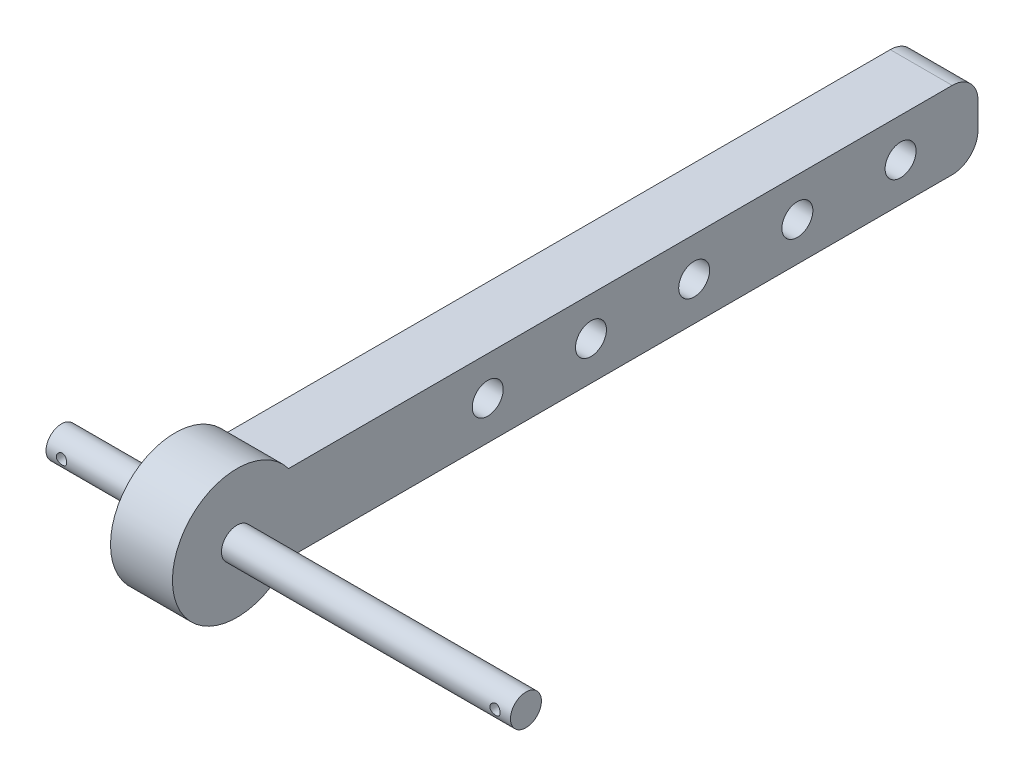
from build123d import *

# Parameters (mm, degrees)
SKETCH_1_W           = 150
SKETCH_1_H           = 15
EXTRUDE_1_DEPTH      = 12
FILLET_1_R           = 5
SKETCH_6_R           = 12.5
EXTRUDE_2_DEPTH      = 12
EXTRUDE_5_DEPTH      = 22
EXTRUDE_5_DEPTH_BACK = 68
SKETCH_15_R          = 3
CUT_EXTRUDE_9_REACH  = 167.904
SKETCH_16_R          = 1
CUT_EXTRUDE_10_REACH = 167.904
SKETCH_17_R          = 3


with BuildPart() as part:
    # 草图1 → 凸台-拉伸1 (new body)
    with BuildSketch(Plane(origin=(0, 0, 0), x_dir=(0, 0, -1), z_dir=(1, 0, 0))):
        with Locations((75, 7.5)):
            Rectangle(SKETCH_1_W, SKETCH_1_H)
    extrude(amount=EXTRUDE_1_DEPTH)

    # 圆角1
    fillet_1_edges = [part.edges().sort_by_distance(p)[0] for p in [
        (6, 15, 0),
        (6, 15, -150),
        (6, 0, -150),
        (6, 0, 0),
    ]]
    fillet(fillet_1_edges, radius=FILLET_1_R)

    # 草图6 → 凸台-拉伸2 (add)
    with BuildSketch(Plane(origin=(12, 0, 0), x_dir=(0, 0, -1), z_dir=(1, 0, 0))):
        with Locations((6.4, 7.5)):
            Circle(SKETCH_6_R)
    extrude(amount=-EXTRUDE_2_DEPTH)

    # 草图15 → 凸台-拉伸5 (add, two sides: drawn at the far end of the back side and taken through both)
    with BuildSketch(Plane.ZY.offset(-EXTRUDE_5_DEPTH_BACK)):
        with Locations((-6.4, 7.5)):
            Circle(SKETCH_15_R)
    extrude(amount=EXTRUDE_5_DEPTH + EXTRUDE_5_DEPTH_BACK)

    # 草图16 → 切除-拉伸9 (cut, up to next)
    with BuildSketch(Plane.XY, mode=Mode.PRIVATE) as cut_extrude_9_sk1:
        with Locations((-19, 7.5)):
            Circle(SKETCH_16_R)
    cut_extrude_9_tool1 = extrude(cut_extrude_9_sk1.sketch, amount=-CUT_EXTRUDE_9_REACH, mode=Mode.PRIVATE) & part.part
    # 草图16 → 切除-拉伸9 (cut, up to next)
    with BuildSketch(Plane.XY, mode=Mode.PRIVATE) as cut_extrude_9_sk2:
        with Locations((65, 7.5)):
            Circle(SKETCH_16_R)
    cut_extrude_9_tool2 = extrude(cut_extrude_9_sk2.sketch, amount=-CUT_EXTRUDE_9_REACH, mode=Mode.PRIVATE) & part.part
    add(cut_extrude_9_tool1.solids().sort_by_distance((-19, 7.5, 0))[0], mode=Mode.SUBTRACT)
    add(cut_extrude_9_tool2.solids().sort_by_distance((65, 7.5, 0))[0], mode=Mode.SUBTRACT)

    # 草图17 → 切除-拉伸10 (cut, up to next)
    with BuildSketch(Plane.ZY, mode=Mode.PRIVATE) as cut_extrude_10_sk1:
        with Locations((-135, 7.5)):
            Circle(SKETCH_17_R)
    cut_extrude_10_tool1 = extrude(cut_extrude_10_sk1.sketch, amount=-CUT_EXTRUDE_10_REACH, mode=Mode.PRIVATE) & part.part
    # 草图17 → 切除-拉伸10 (cut, up to next)
    with BuildSketch(Plane.ZY, mode=Mode.PRIVATE) as cut_extrude_10_sk2:
        with Locations((-115, 7.5)):
            Circle(SKETCH_17_R)
    cut_extrude_10_tool2 = extrude(cut_extrude_10_sk2.sketch, amount=-CUT_EXTRUDE_10_REACH, mode=Mode.PRIVATE) & part.part
    # 草图17 → 切除-拉伸10 (cut, up to next)
    with BuildSketch(Plane.ZY, mode=Mode.PRIVATE) as cut_extrude_10_sk3:
        with Locations((-95, 7.5)):
            Circle(SKETCH_17_R)
    cut_extrude_10_tool3 = extrude(cut_extrude_10_sk3.sketch, amount=-CUT_EXTRUDE_10_REACH, mode=Mode.PRIVATE) & part.part
    # 草图17 → 切除-拉伸10 (cut, up to next)
    with BuildSketch(Plane.ZY, mode=Mode.PRIVATE) as cut_extrude_10_sk4:
        with Locations((-75, 7.5)):
            Circle(SKETCH_17_R)
    cut_extrude_10_tool4 = extrude(cut_extrude_10_sk4.sketch, amount=-CUT_EXTRUDE_10_REACH, mode=Mode.PRIVATE) & part.part
    # 草图17 → 切除-拉伸10 (cut, up to next)
    with BuildSketch(Plane.ZY, mode=Mode.PRIVATE) as cut_extrude_10_sk5:
        with Locations((-55, 7.5)):
            Circle(SKETCH_17_R)
    cut_extrude_10_tool5 = extrude(cut_extrude_10_sk5.sketch, amount=-CUT_EXTRUDE_10_REACH, mode=Mode.PRIVATE) & part.part
    add(cut_extrude_10_tool1.solids().sort_by_distance((0, 7.5, -135))[0], mode=Mode.SUBTRACT)
    add(cut_extrude_10_tool2.solids().sort_by_distance((0, 7.5, -115))[0], mode=Mode.SUBTRACT)
    add(cut_extrude_10_tool3.solids().sort_by_distance((0, 7.5, -95))[0], mode=Mode.SUBTRACT)
    add(cut_extrude_10_tool4.solids().sort_by_distance((0, 7.5, -75))[0], mode=Mode.SUBTRACT)
    add(cut_extrude_10_tool5.solids().sort_by_distance((0, 7.5, -55))[0], mode=Mode.SUBTRACT)


solid = part.part
